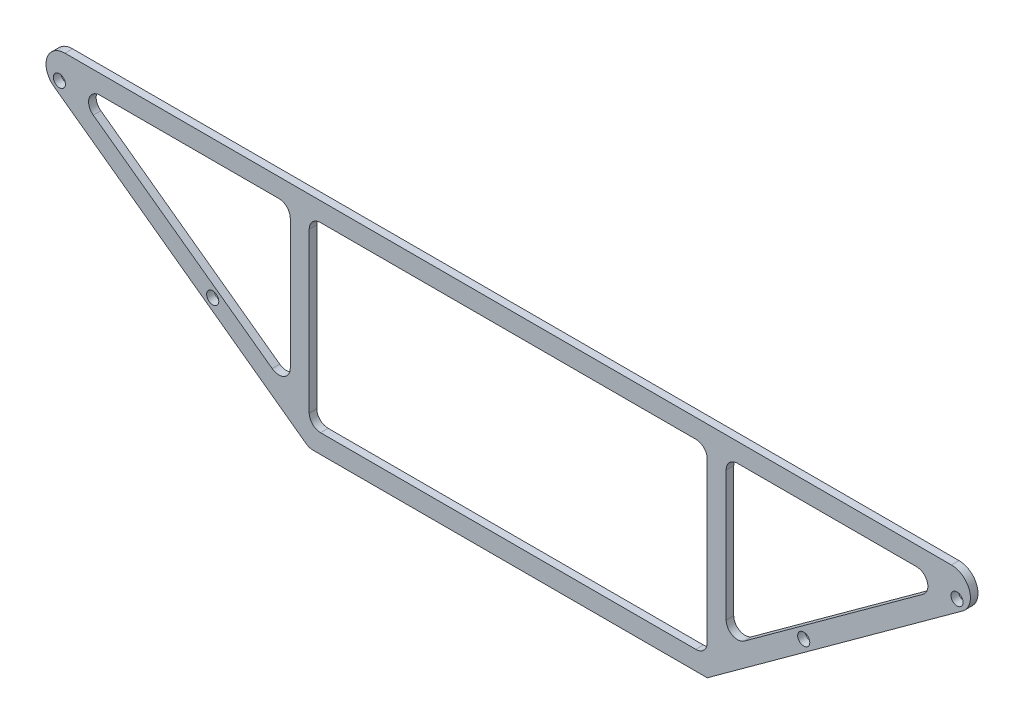
from build123d import *

# Parameters (mm, degrees)
SKETCH_1_R      = 1.6
SKETCH_1_W      = 105
SKETCH_1_H      = 48
EXTRUDE_1_DEPTH = 2
FILLET_1_R      = 3


with BuildPart() as part:
    # ｽｹｯﾁ1 → ﾎﾞｽ - 押し出し1 (new body)
    with BuildSketch(Plane.XY):
        with BuildLine():
            Line((-116.941733701, 29), (116.941733701, 29))
            ThreePointArc((116.941733701, 29), (121.697016283, 25.545084972), (119.880659963, 19.954915028))
            Line((119.880659963, 19.954915028), (52.5, -29))
            Line((52.5, -29), (-52.5, -29))
            Line((-52.5, -29), (-119.880659963, 19.954915028))
            ThreePointArc((-119.880659963, 19.954915028), (-121.697016283, 25.545084972), (-116.941733701, 29))
        make_face()
        with Locations((118.411196832, 21.977457514)):
            Circle(SKETCH_1_R, mode=Mode.SUBTRACT)
        with Locations((77.960347113, -7.411805101)):
            Circle(SKETCH_1_R, mode=Mode.SUBTRACT)
        with Locations(Location((-118.411196832, 21.977457514, 0), (0, 0, 180))):
            Circle(SKETCH_1_R, mode=Mode.SUBTRACT)
        with Locations(Location((-77.960347113, -7.411805101, 0), (0, 0, 180))):
            Circle(SKETCH_1_R, mode=Mode.SUBTRACT)
        Rectangle(SKETCH_1_W, SKETCH_1_H, mode=Mode.SUBTRACT)
        with BuildLine():
            Line((-57.5, 21), (-57.5, -13.299115956))
            ThreePointArc((-57.5, -13.299115956), (-59.138028501, -15.972135529), (-62.263355757, -15.726166939))
            Line((-62.263355757, -15.726166939), (-116.941733701, 24))
            Line((-116.941733701, 24), (-60.5, 24))
            ThreePointArc((-60.5, 24), (-58.378679656, 23.121320344), (-57.5, 21))
        make_face(mode=Mode.SUBTRACT)
        with BuildLine():
            Line((62.263355757, -15.726166939), (116.941733701, 24))
            Line((116.941733701, 24), (60.5, 24))
            ThreePointArc((60.5, 24), (58.378679656, 23.121320344), (57.5, 21))
            Line((57.5, 21), (57.5, -13.299115956))
            ThreePointArc((57.5, -13.299115956), (59.138028501, -15.972135529), (62.263355757, -15.726166939))
        make_face(mode=Mode.SUBTRACT)
    extrude(amount=EXTRUDE_1_DEPTH)

    # ﾌｨﾚｯﾄ1
    fillet_1_edges = [part.edges().sort_by_distance(p)[0] for p in [
        (-52.5, -29, 1),
        (-52.5, 24, 1),
        (-52.5, -24, 1),
        (52.5, -24, 1),
        (52.5, 24, 1),
        (116.941733701, 24, 1),
        (-116.941733701, 24, 1),
    ]]
    fillet(fillet_1_edges, radius=FILLET_1_R)


solid = part.part
